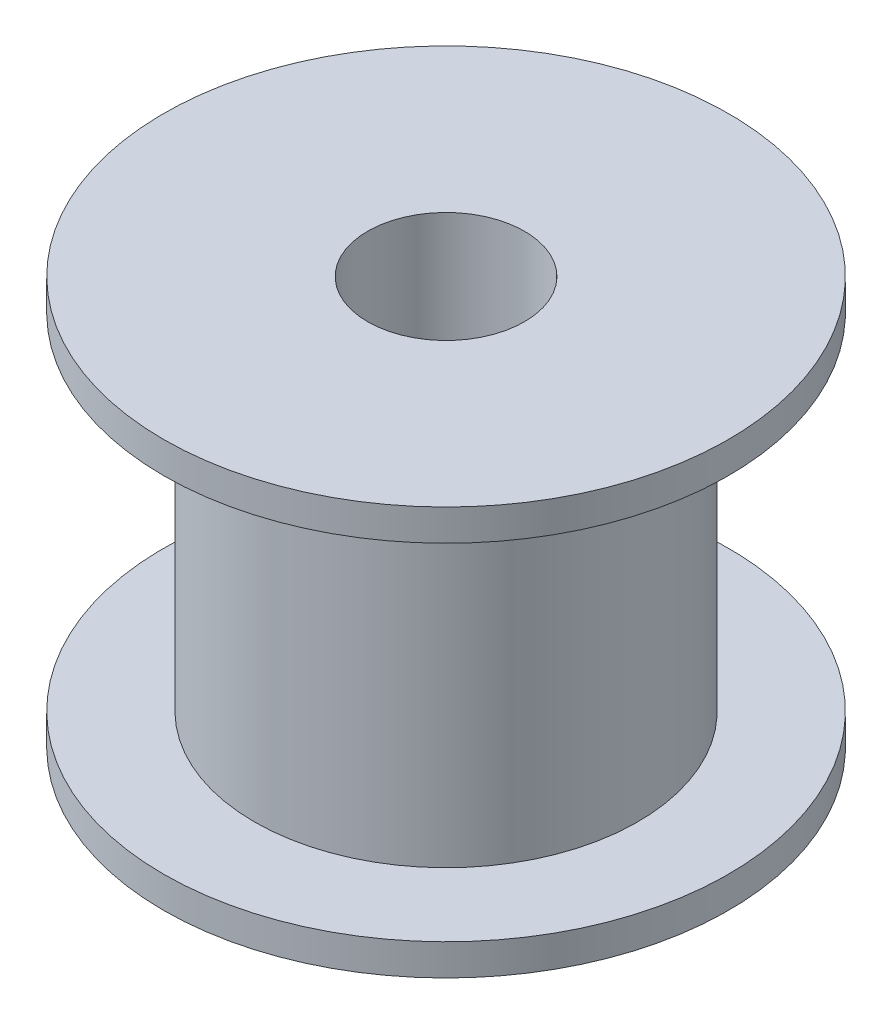
from build123d import *

# Parameters (mm, degrees)
SKETCH_1_R          = 9
EXTRUDE_1_DEPTH     = 1
SKETCH_2_R          = 6.11
EXTRUDE_2_DEPTH     = 11
SKETCH_3_R          = 9
EXTRUDE_3_DEPTH     = 1
SKETCH_4_R          = 2.5
CUT_EXTRUDE_1_DEPTH = 13


with BuildPart() as part:
    # 草图1 → 凸台-拉伸1 (new body)
    with BuildSketch(Plane(origin=(0, 0, 0), x_dir=(1, 0, 0), z_dir=(0, 1, 0))):
        with Locations(Location((0, 0, 0), (0, 0, 270))):
            Circle(SKETCH_1_R)
    extrude(amount=EXTRUDE_1_DEPTH)

    # 草图2 → 凸台-拉伸2 (add)
    with BuildSketch(Plane(origin=(0, 1, 0), x_dir=(1, 0, 0), z_dir=(0, 1, 0))):
        with Locations(Location((0, 0, 0), (0, 0, 270))):
            Circle(SKETCH_2_R)
    extrude(amount=EXTRUDE_2_DEPTH)

    # 草图3 → 凸台-拉伸3 (add)
    with BuildSketch(Plane(origin=(0, 12, 0), x_dir=(1, 0, 0), z_dir=(0, 1, 0))):
        with Locations(Location((0, 0, 0), (0, 0, 270))):
            Circle(SKETCH_3_R)
    extrude(amount=EXTRUDE_3_DEPTH)

    # 草图4 → 切除-拉伸1 (cut)
    with BuildSketch(Plane(origin=(0, 13, 0), x_dir=(1, 0, 0), z_dir=(0, 1, 0))):
        with Locations(Location((0, 0, 0), (0, 0, 270))):
            Circle(SKETCH_4_R)
    extrude(amount=-CUT_EXTRUDE_1_DEPTH, mode=Mode.SUBTRACT)


solid = part.part
